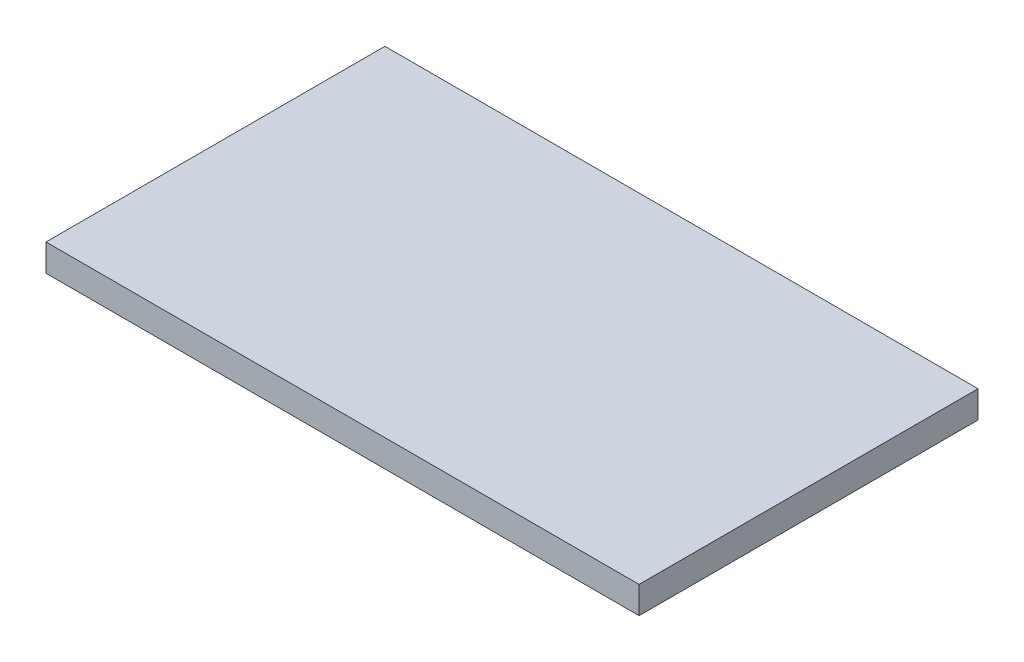
from build123d import *

# Parameters (mm, degrees)
SKETCH1_W           = 35
SKETCH1_H           = 20
BOSS_EXTRUDE1_DEPTH = 1.6


with BuildPart() as part:
    # Sketch1 → Boss-Extrude1 (new body)
    with BuildSketch(Plane(origin=(0, 0, 0), x_dir=(1, 0, 0), z_dir=(0, 1, 0))):
        with Locations((17.5, 10)):
            Rectangle(SKETCH1_W, SKETCH1_H)
    extrude(amount=BOSS_EXTRUDE1_DEPTH)


solid = part.part
